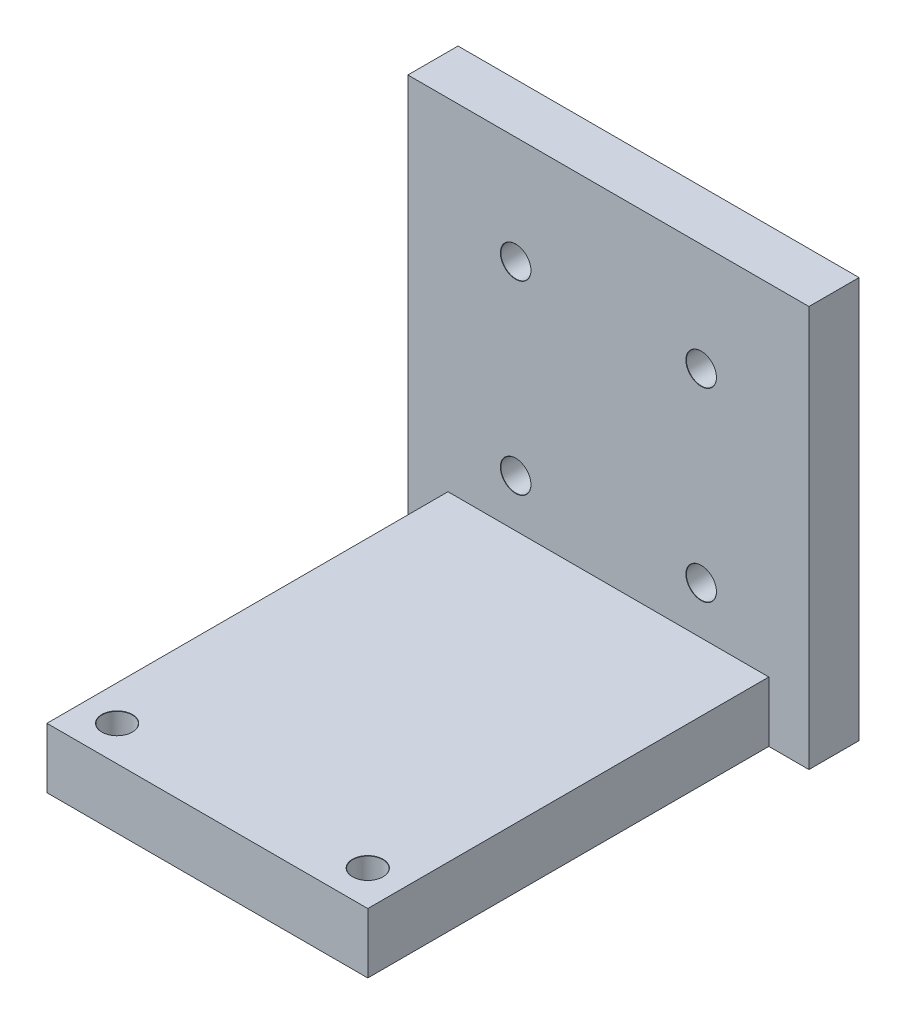
from build123d import *

# Parameters (mm, degrees)
SZKIC1_W                             = 40
SZKIC1_H                             = 40
DODANIE_WYCI_GNI_CIE1_DEPTH          = 5
OTWORY_USTALAJ_CE_3_0MM1_D           = 3
OTWORY_USTALAJ_CE_3_0MM1_CSINK_D     = 3.05
OTWORY_USTALAJ_CE_3_0MM1_CSINK_ANGLE = 90
SZKIC4_W                             = 32
SZKIC4_H                             = 6
DODANIE_WYCI_GNI_CIE2_DEPTH          = 40
OTWORY_USTALAJ_CE_3_0MM2_D           = 3
OTWORY_USTALAJ_CE_3_0MM2_CSINK_D     = 3.05
OTWORY_USTALAJ_CE_3_0MM2_CSINK_ANGLE = 90


with BuildPart() as part:
    # Szkic1 → Dodanie-wyciągnięcie1 (new body)
    with BuildSketch(Plane.XY):
        with Locations((20, 20)):
            Rectangle(SZKIC1_W, SZKIC1_H)
    extrude(amount=DODANIE_WYCI_GNI_CIE1_DEPTH)

    # Otwory ustalające Ø3.0mm1 (through all)
    with Locations(Plane.XY.offset(5)):
        with Locations((10.75, 29.25), (29.25, 29.25), (10.75, 10.75), (29.25, 10.75)):
            CounterSinkHole(OTWORY_USTALAJ_CE_3_0MM1_D / 2, OTWORY_USTALAJ_CE_3_0MM1_CSINK_D / 2, counter_sink_angle=OTWORY_USTALAJ_CE_3_0MM1_CSINK_ANGLE)

    # Szkic4 → Dodanie-wyciągnięcie2 (add)
    with BuildSketch(Plane.XY.offset(5)):
        with Locations((20, 3)):
            Rectangle(SZKIC4_W, SZKIC4_H)
    extrude(amount=DODANIE_WYCI_GNI_CIE2_DEPTH)

    # Otwory ustalające Ø3.0mm2 (through all)
    with Locations(Plane(origin=(0, 6, 0), x_dir=(1, 0, 0), z_dir=(0, 1, 0))):
        with Locations((7.5, -41.5), (32.5, -41.5)):
            CounterSinkHole(OTWORY_USTALAJ_CE_3_0MM2_D / 2, OTWORY_USTALAJ_CE_3_0MM2_CSINK_D / 2, counter_sink_angle=OTWORY_USTALAJ_CE_3_0MM2_CSINK_ANGLE)


solid = part.part
